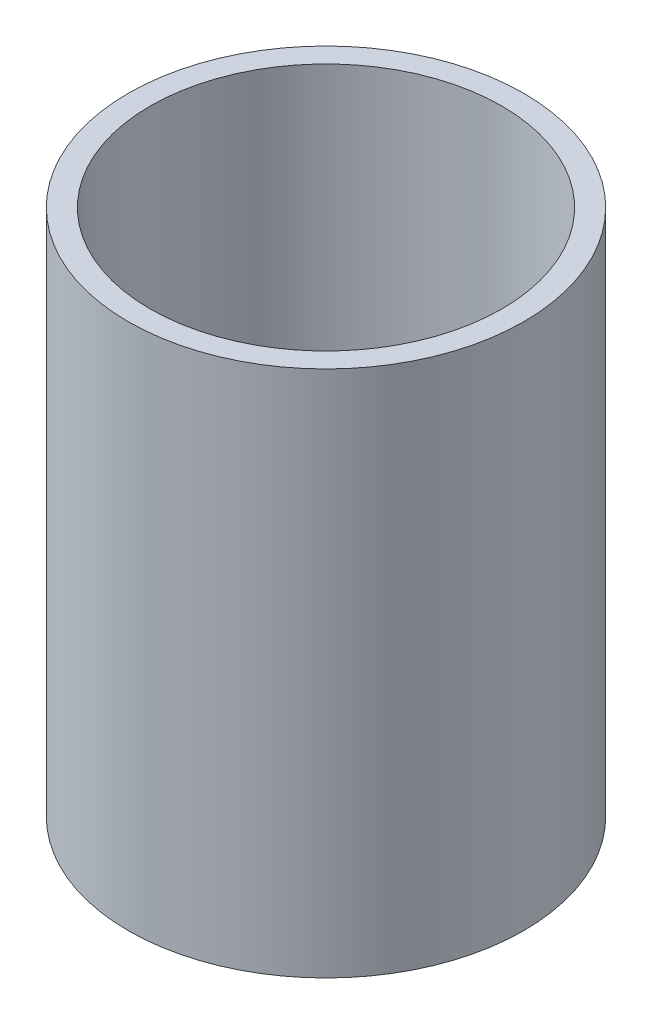
from build123d import *

# Parameters (mm, degrees)
SKETCH1_R           = 28.575
SKETCH1_R_2         = 25.4
BOSS_EXTRUDE1_DEPTH = 38.1


with BuildPart() as part:
    # Sketch1 → Boss-Extrude1 (new, symmetric)
    with BuildSketch(Plane(origin=(0, 0, 0), x_dir=(1, 0, 0), z_dir=(0, 1, 0))):
        with Locations(Location((0, 0, 0), (0, 0, 270))):
            Circle(SKETCH1_R)
        with Locations(Location((0, 0, 0), (0, 0, 270))):
            Circle(SKETCH1_R_2, mode=Mode.SUBTRACT)
    extrude(amount=BOSS_EXTRUDE1_DEPTH, both=True)


solid = part.part
